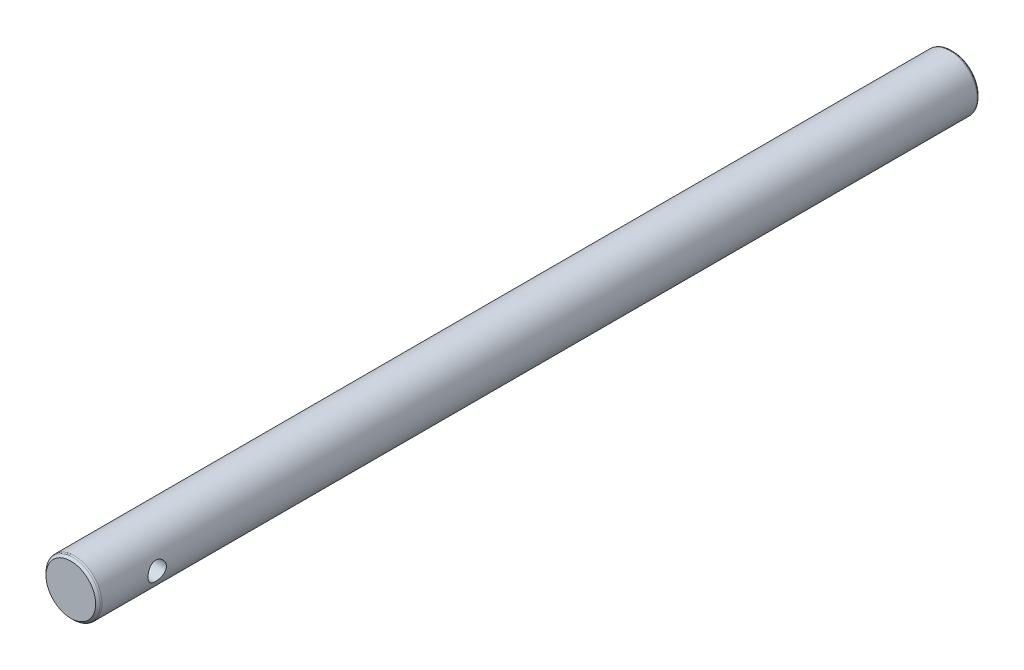
from build123d import *

# Parameters (mm, degrees)
SKETCH3_R           = 4.7625
BOSS_EXTRUDE1_DEPTH = 76.2
CHAMFER1_SIZE       = 0.47625
FILLET2_R           = 0.3571875
SKETCH4_R           = 1.5875
CUT_EXTRUDE1_DEPTH  = 362.708529549


with BuildPart() as part:
    # Sketch3 → Boss-Extrude1 (new, symmetric)
    with BuildSketch(Plane.XY):
        with Locations(Location((0, 0, 0), (0, 0, 180))):
            Circle(SKETCH3_R)
    extrude(amount=BOSS_EXTRUDE1_DEPTH, both=True)

    # Chamfer1
    chamfer1_edges = [part.edges().sort_by_distance(p)[0] for p in [
        (4.7625, 0, -76.2),
        (4.7625, 0, 76.2),
    ]]
    chamfer(chamfer1_edges, length=CHAMFER1_SIZE)

    # Fillet2
    fillet2_edges = [part.edges().sort_by_distance(p)[0] for p in [
        (4.7625, 0, -75.72375),
        (4.7625, 0, 75.72375),
    ]]
    fillet(fillet2_edges, radius=FILLET2_R)

    # Sketch4 → Cut-Extrude1 (cut, through all)
    with BuildSketch(Plane(origin=(-4.7625, -167.656009053, -241.627303232), x_dir=(0, 0, 1), z_dir=(-1, 0, 0))):
        with Locations((307.667303232, 167.656009053)):
            Circle(SKETCH4_R)
    extrude(amount=-CUT_EXTRUDE1_DEPTH, mode=Mode.SUBTRACT)


solid = part.part
